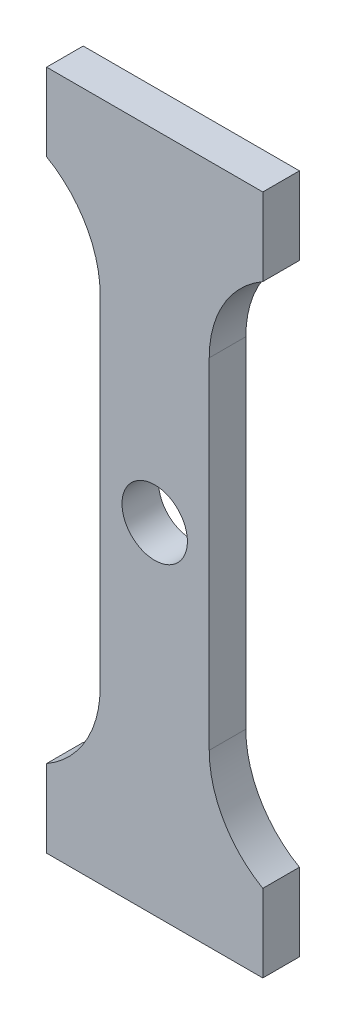
from build123d import *

# Parameters (mm, degrees)
SKETCH1_R           = 8.939106544
BOSS_EXTRUDE1_DEPTH = 10


with BuildPart() as part:
    # Sketch1 → Boss-Extrude1 (new body)
    with BuildSketch(Plane.XY):
        with BuildLine():
            Line((29.527184843, 92.970730655), (-29.527184843, 92.970730655))
            Line((-29.527184843, 92.970730655), (-29.527184843, 71.764892873))
            ThreePointArc((-29.527184843, 71.764892873), (-18.816760055, 61.051662511), (-14.896597759, 46.418862659))
            Line((-14.896597759, 46.418862659), (-14.896597759, -46.418862659))
            ThreePointArc((-14.896597759, -46.418862659), (-18.816760055, -61.051662511), (-29.527184843, -71.764892873))
            Line((-29.527184843, -71.764892873), (-29.527184843, -92.970730655))
            Line((-29.527184843, -92.970730655), (29.527184843, -92.970730655))
            Line((29.527184843, -92.970730655), (29.527184843, -71.764892873))
            ThreePointArc((29.527184843, -71.764892873), (18.816760055, -61.051662511), (14.896597759, -46.418862659))
            Line((14.896597759, -46.418862659), (14.896597759, 46.418862659))
            ThreePointArc((14.896597759, 46.418862659), (18.816760055, 61.051662511), (29.527184843, 71.764892873))
            Line((29.527184843, 71.764892873), (29.527184843, 92.970730655))
        make_face()
        Circle(SKETCH1_R, mode=Mode.SUBTRACT)
    extrude(amount=BOSS_EXTRUDE1_DEPTH)


solid = part.part
